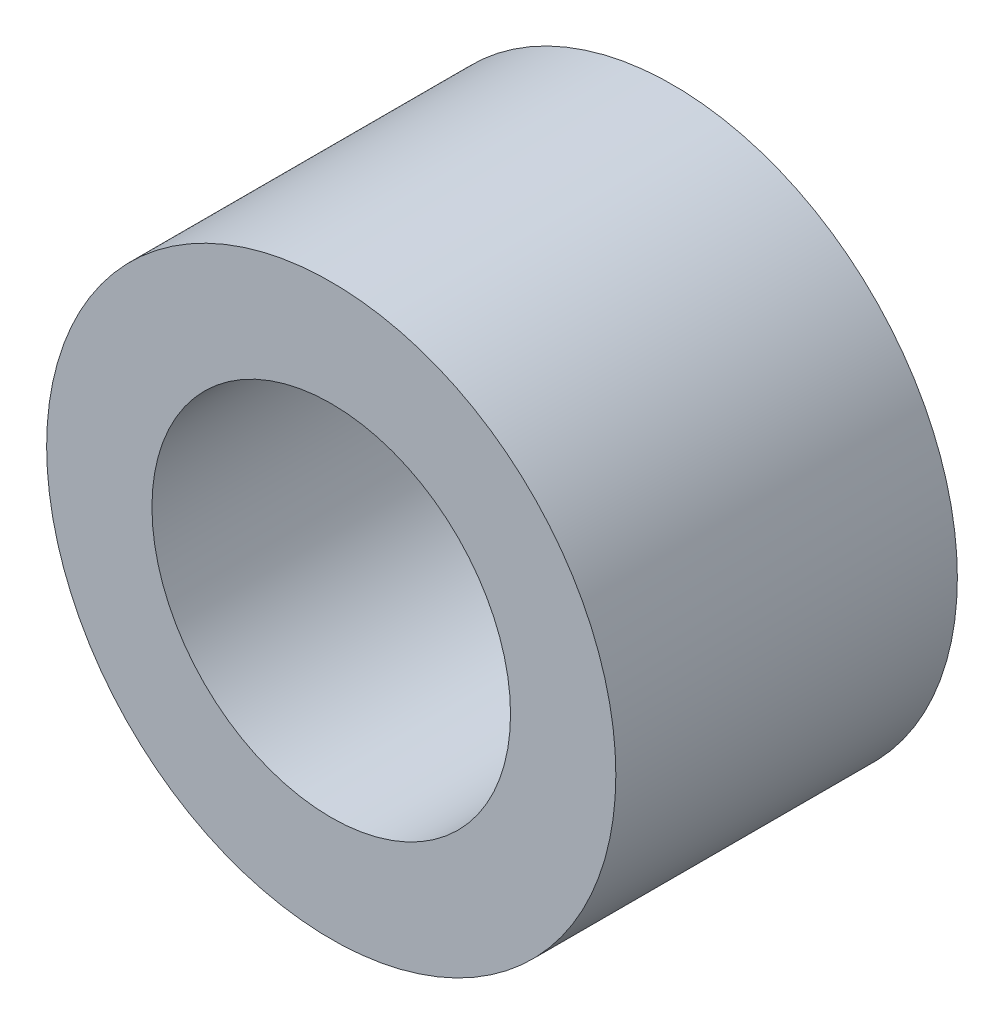
from build123d import *

# Parameters (mm, degrees)
SKETCH1_R      = 5
SKETCH1_R_2    = 3.15
EXTRUDE1_DEPTH = 3


with BuildPart() as part:
    # Sketch1 → Extrude1 (new, symmetric)
    with BuildSketch(Plane.XY):
        Circle(SKETCH1_R)
        Circle(SKETCH1_R_2, mode=Mode.SUBTRACT)
    extrude(amount=EXTRUDE1_DEPTH, both=True)


solid = part.part
